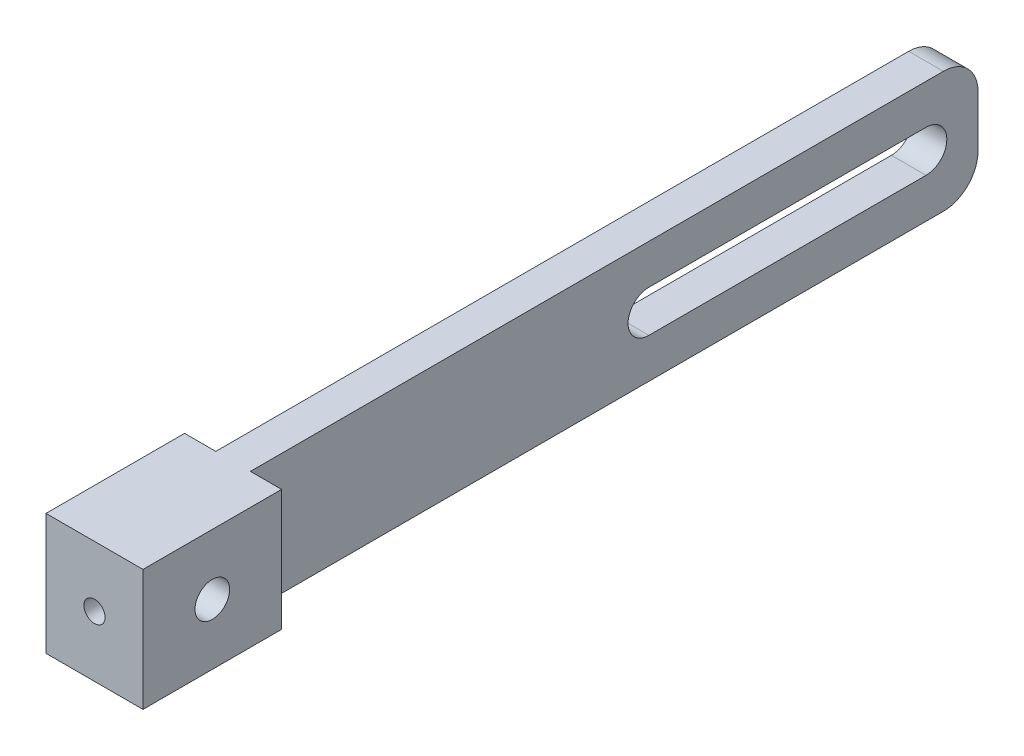
from build123d import *

# Parameters (mm, degrees)
SKETCH1_W                = 28
SKETCH1_H                = 35
SKETCH1_R                = 3.05
BOSS_EXTRUDE1_DEPTH      = 40
CUT_EXTRUDE1_DEPTH       = 46.85029989
CUT_EXTRUDE1_DEPTH_BACK  = 46.85029989
SKETCH2_R                = 5
BOSS_EXTRUDE2_DEPTH      = 5
BOSS_EXTRUDE2_DEPTH_BACK = 5
SKETCH4_W                = 210
SKETCH4_H                = 35
FILLET1_R                = 10


with BuildPart() as part:
    # Sketch1 → Boss-Extrude1 (new body)
    with BuildSketch(Plane.XY):
        Rectangle(SKETCH1_W, SKETCH1_H)
        Circle(SKETCH1_R, mode=Mode.SUBTRACT)
    extrude(amount=-BOSS_EXTRUDE1_DEPTH)

    # Sketch2 → Cut-Extrude1 (cut, two sides: drawn at the far end of the back side and taken through both)
    with BuildSketch(Plane(origin=(0, 0, 0), x_dir=(0, 0, -1), z_dir=(1, 0, 0)).offset(-CUT_EXTRUDE1_DEPTH_BACK)):
        with Locations((20, 0)):
            Circle(SKETCH2_R)
    extrude(amount=CUT_EXTRUDE1_DEPTH + CUT_EXTRUDE1_DEPTH_BACK, mode=Mode.SUBTRACT)

    # Sketch4 → Boss-Extrude2 (add, two sides: drawn at the far end of the back side and taken through both)
    with BuildSketch(Plane(origin=(0, 0, 0), x_dir=(0, 0, -1), z_dir=(1, 0, 0)).offset(-BOSS_EXTRUDE2_DEPTH_BACK)):
        with Locations((145, 0)):
            Rectangle(SKETCH4_W, SKETCH4_H)
        with BuildLine():
            Line((235, -6), (155, -6))
            ThreePointArc((155, -6), (149, 0), (155, 6))
            Line((155, 6), (235, 6))
            ThreePointArc((235, 6), (241, 0), (235, -6))
        make_face(mode=Mode.SUBTRACT)
    extrude(amount=BOSS_EXTRUDE2_DEPTH + BOSS_EXTRUDE2_DEPTH_BACK)

    # Fillet1
    fillet1_edges = [part.edges().sort_by_distance(p)[0] for p in [
        (0, 17.5, -250),
        (0, -17.5, -250),
    ]]
    fillet(fillet1_edges, radius=FILLET1_R)


solid = part.part
